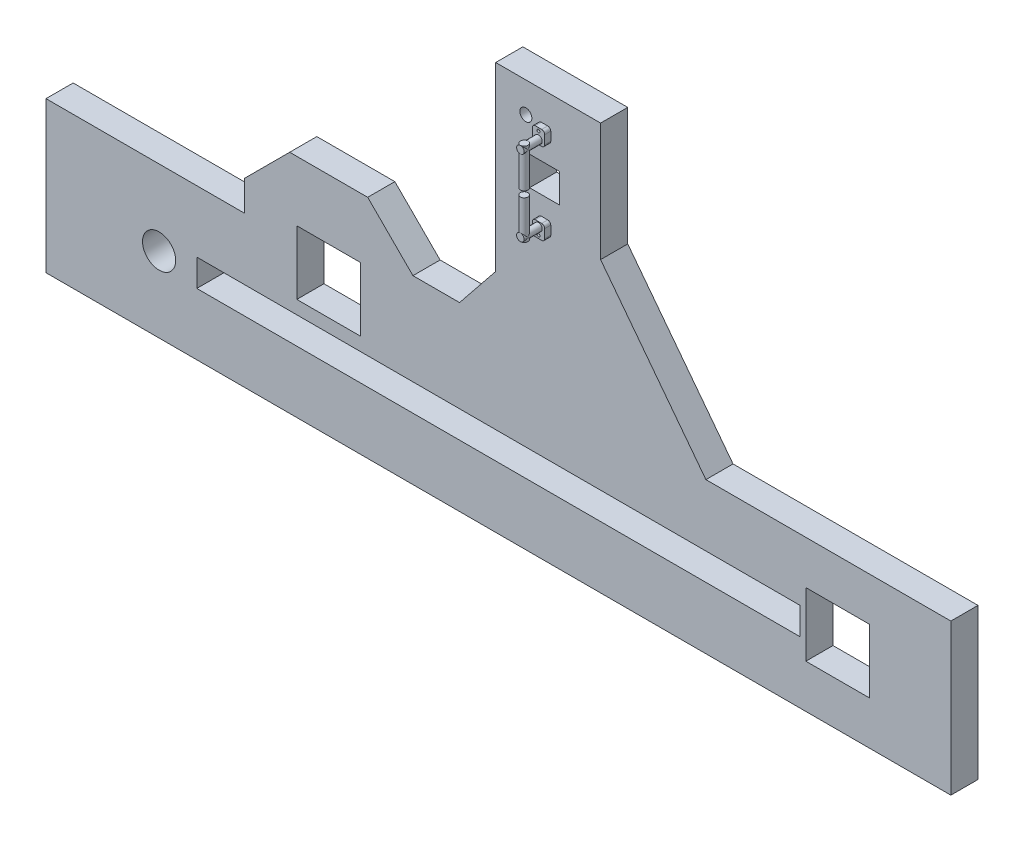
from build123d import *
from build123d.topology import SkipClean

# Parameters (mm, degrees)
SCHIZZO1_W                   = 600
SCHIZZO1_H                   = 100
ESTRUSIONE_ESTRUSIONE1_DEPTH = 18
SCHIZZO2_W                   = 400
SCHIZZO2_H                   = 18
TAGLIO_ESTRUSIONE1_DEPTH     = 18
SCHIZZO3_R                   = 11
TAGLIO_ESTRUSIONE2_DEPTH     = 18
SCHIZZO7_W                   = 111.74591768
SCHIZZO7_H                   = 50
ESTRUSIONE_ESTRUSIONE2_DEPTH = 18
SCHIZZO4_W                   = 42.3
SCHIZZO4_H                   = 42.3
TAGLIO_ESTRUSIONE4_DEPTH     = 18
SMUSSO1_SIZE                 = 30
ESTRUSIONE_ESTRUSIONE3_DEPTH = 18
ESTRUSIONE_ESTRUSIONE4_DEPTH = 18
SCHIZZO11_W                  = 42.3
SCHIZZO11_H                  = 42.3
TAGLIO_ESTRUSIONE5_DEPTH     = 28
ESTRUSIONE_ESTRUSIONE5_DEPTH = 18
SCHIZZO13_W                  = 19.88
SCHIZZO13_H                  = 19.28
TAGLIO_ESTRUSIONE6_DEPTH     = 41
SCHIZZO14_W                  = 8.269239625
SCHIZZO14_H                  = 9.762509537
ESTRUSIONE_ESTRUSIONE6_DEPTH = 4
RACCORDO1_R                  = 2
SCHIZZO16_R                  = 1
TAGLIO_ESTRUSIONE7_DEPTH     = 4
RACCORDO1_OF_SPECCHIA5_R     = 2
SCHIZZO18_R                  = 2.5
ESTRUSIONE_ESTRUSIONE7_DEPTH = 12
SCHIZZO19_R                  = 2.5
ESTRUSIONE_ESTRUSIONE8_DEPTH = 55.3
SCHIZZO20_W                  = 5
SCHIZZO20_H                  = 4
TAGLIO_ESTRUSIONE9_DEPTH     = 55.3


with BuildPart() as part:
    # Schizzo1 → Estrusione-Estrusione1 (new body)
    with BuildSketch(Plane.XY):
        Rectangle(SCHIZZO1_W, SCHIZZO1_H)
    extrude(amount=ESTRUSIONE_ESTRUSIONE1_DEPTH)

    # Schizzo2 → Taglio-Estrusione1 (cut)
    with BuildSketch(Plane.XY.offset(18)):
        Rectangle(SCHIZZO2_W, SCHIZZO2_H)
    extrude(amount=-TAGLIO_ESTRUSIONE1_DEPTH, mode=Mode.SUBTRACT)

    # Schizzo3 → Taglio-Estrusione2 (cut)
    with BuildSketch(Plane.XY.offset(18)):
        with Locations((-225, 0)):
            Circle(SCHIZZO3_R)
    taglio_estrusione2 = extrude(amount=-TAGLIO_ESTRUSIONE2_DEPTH, mode=Mode.SUBTRACT)

    # Specchia1: Taglio-Estrusione2 across plane
    add(taglio_estrusione2.mirror(Plane(origin=(0, 0, 0), x_dir=(0, 0, 1), z_dir=(1, 0, 0))), mode=Mode.SUBTRACT)

    # Schizzo7 → Estrusione-Estrusione2 (add)
    with BuildSketch(Plane.XY.offset(18)):
        with Locations((-112.550055679, 75)):
            Rectangle(SCHIZZO7_W, SCHIZZO7_H)
    extrude(amount=-ESTRUSIONE_ESTRUSIONE2_DEPTH)

    # Schizzo4 → Taglio-Estrusione4 (cut)
    with BuildSketch(Plane.XY.offset(18)):
        with Locations((-112.550055679, 39)):
            Rectangle(SCHIZZO4_W, SCHIZZO4_H)
    extrude(amount=-TAGLIO_ESTRUSIONE4_DEPTH, mode=Mode.SUBTRACT)

    # Smusso1
    smusso1_edges = [part.edges().sort_by_distance(p)[0] for p in [
        (-168.423014519, 100, 9),
        (-56.677096839, 100, 9),
    ]]
    chamfer(smusso1_edges, length=SMUSSO1_SIZE)

    # Schizzo9 → Estrusione-Estrusione3 (add)
    with BuildSketch(Plane.XY.offset(18)):
        with BuildLine():
            Line((38.183130708, 219.840421954), (18.183130708, 219.840421954))
            Line((18.183130708, 219.840421954), (18.183130708, 203.840421954))
            ThreePointArc((18.183130708, 203.840421954), (21.011557833, 202.668849079), (22.183130708, 199.840421954))
            ThreePointArc((22.183130708, 199.840421954), (21.011557833, 197.011994829), (18.183130708, 195.840421954))
            Line((18.183130708, 195.840421954), (18.183130708, 138.750421954))
            ThreePointArc((18.183130708, 138.750421954), (21.011557833, 137.578849079), (22.183130708, 134.750421954))
            ThreePointArc((22.183130708, 134.750421954), (21.011557833, 131.921994829), (18.183130708, 130.750421954))
            Line((18.183130708, 130.750421954), (18.183130708, 50))
            Line((18.183130708, 50), (78.183130708, 50))
            Line((78.183130708, 50), (38.183130708, 99.840421954))
            Line((38.183130708, 99.840421954), (38.183130708, 219.840421954))
        make_face()
        with BuildLine():
            Line((-1.816869292, 219.840421954), (-1.816869292, 99.840421954))
            Line((-1.816869292, 99.840421954), (-41.816869292, 50))
            Line((-41.816869292, 50), (18.183130708, 50))
            Line((18.183130708, 50), (18.183130708, 130.750421954))
            ThreePointArc((18.183130708, 130.750421954), (14.183130708, 134.750421954), (18.183130708, 138.750421954))
            Line((18.183130708, 138.750421954), (18.183130708, 195.840421954))
            ThreePointArc((18.183130708, 195.840421954), (14.183130708, 199.840421954), (18.183130708, 203.840421954))
            Line((18.183130708, 203.840421954), (18.183130708, 219.840421954))
            Line((18.183130708, 219.840421954), (-1.816869292, 219.840421954))
        make_face()
    extrude(amount=-ESTRUSIONE_ESTRUSIONE3_DEPTH)

    # Schizzo10 → Estrusione-Estrusione4 (add)
    with BuildSketch(Plane.XY.offset(18)):
        Polygon((-56.677096839, 70), (-25.765640818, 70), (-41.816869292, 50), (-56.677096839, 50), align=None)
    extrude(amount=-ESTRUSIONE_ESTRUSIONE4_DEPTH)

    # Schizzo11 → Taglio-Estrusione5 (cut)
    with BuildSketch(Plane.XY.offset(18)):
        with Locations((225, 0)):
            Rectangle(SCHIZZO11_W, SCHIZZO11_H)
    extrude(amount=-TAGLIO_ESTRUSIONE5_DEPTH, mode=Mode.SUBTRACT)

    # Schizzo12 → Estrusione-Estrusione5 (add)
    with BuildSketch(Plane.XY.offset(18)):
        Polygon((38.183130708, 219.840421954), (67.743130708, 219.840421954), (67.743130708, 141.424386042), (137.571552976, 50), (78.183130708, 50), (67.743130708, 63.00835013), (38.183130708, 99.840421954), align=None)
    extrude(amount=-ESTRUSIONE_ESTRUSIONE5_DEPTH)

    # Schizzo13 → Taglio-Estrusione6 (cut)
    with BuildSketch(Plane(origin=(0, 0, 0), x_dir=(-1, 0, 0), z_dir=(0, 0, -1))):
        with Locations((-30.563130708, 168.780421954)):
            Rectangle(SCHIZZO13_W, SCHIZZO13_H)
    extrude(amount=-TAGLIO_ESTRUSIONE6_DEPTH, mode=Mode.SUBTRACT)

    # Schizzo14 → Estrusione-Estrusione6 (add)
    with BuildSketch(Plane.XY.offset(18)):
        with Locations((30.563130709, 195.780866329)):
            Rectangle(SCHIZZO14_W, SCHIZZO14_H)
    estrusione_estrusione6 = extrude(amount=ESTRUSIONE_ESTRUSIONE6_DEPTH)

    # Raccordo1
    raccordo1_edges = [part.edges().sort_by_distance(p)[0] for p in [
        (26.428510896, 200.662121098, 20),
        (26.428510896, 190.899611561, 20),
        (34.697750521, 190.899611561, 20),
        (34.697750521, 200.662121098, 20),
    ]]
    fillet(raccordo1_edges, radius=RACCORDO1_R)

    # Schizzo16 → Taglio-Estrusione7 (cut)
    with BuildSketch(Plane.XY.offset(22)):
        with Locations((30.563130708, 198.683981815)):
            Circle(SCHIZZO16_R)
    taglio_estrusione7 = extrude(amount=-TAGLIO_ESTRUSIONE7_DEPTH, mode=Mode.SUBTRACT)

    # Specchia5: Estrusione-Estrusione6, Taglio-Estrusione7 across plane
    add(estrusione_estrusione6.mirror(Plane.ZX.offset(168.8)))
    add(taglio_estrusione7.mirror(Plane.ZX.offset(168.8)), mode=Mode.SUBTRACT)

    # Raccordo1 of Specchia5
    raccordo1_of_specchia5_edges = [part.edges().sort_by_distance(p)[0] for p in [
        (26.428510896, 136.937878902, 20),
        (26.428510896, 146.700388439, 20),
        (34.697750521, 146.700388439, 20),
        (34.697750521, 136.937878902, 20),
    ]]
    fillet(raccordo1_of_specchia5_edges, radius=RACCORDO1_OF_SPECCHIA5_R)

    # Schizzo18 → Estrusione-Estrusione7 (add)
    with BuildSketch(Plane.XY.offset(22)):
        with Locations((30.563130708, 193.953084235)):
            Circle(SCHIZZO18_R)
    estrusione_estrusione7 = extrude(amount=ESTRUSIONE_ESTRUSIONE7_DEPTH)

    # Specchia6: Estrusione-Estrusione7 across plane
    add(estrusione_estrusione7.mirror(Plane.ZX.offset(168.8)))

    # Schizzo19 → Estrusione-Estrusione8 (add)
    with SkipClean():  # the faces are left unmerged after this step: merging them gives an invalid solid
        with BuildSketch(Plane(origin=(0, 196.453084235, 0), x_dir=(1, 0, 0), z_dir=(0, 1, 0))):
            with Locations(Location((30.563130708, -31.5, 0), (0, 0, 270))):
                Circle(SCHIZZO19_R)
        extrude(amount=-ESTRUSIONE_ESTRUSIONE8_DEPTH)

    # Schizzo20 → Taglio-Estrusione9 (cut)
    with SkipClean():  # the faces are left unmerged after this step: merging them gives an invalid solid
        with BuildSketch(Plane.XY.offset(34)):
            with Locations((30.563130708, 168.8)):
                Rectangle(SCHIZZO20_W, SCHIZZO20_H)
        extrude(amount=-TAGLIO_ESTRUSIONE9_DEPTH, mode=Mode.SUBTRACT)


solid = part.part
